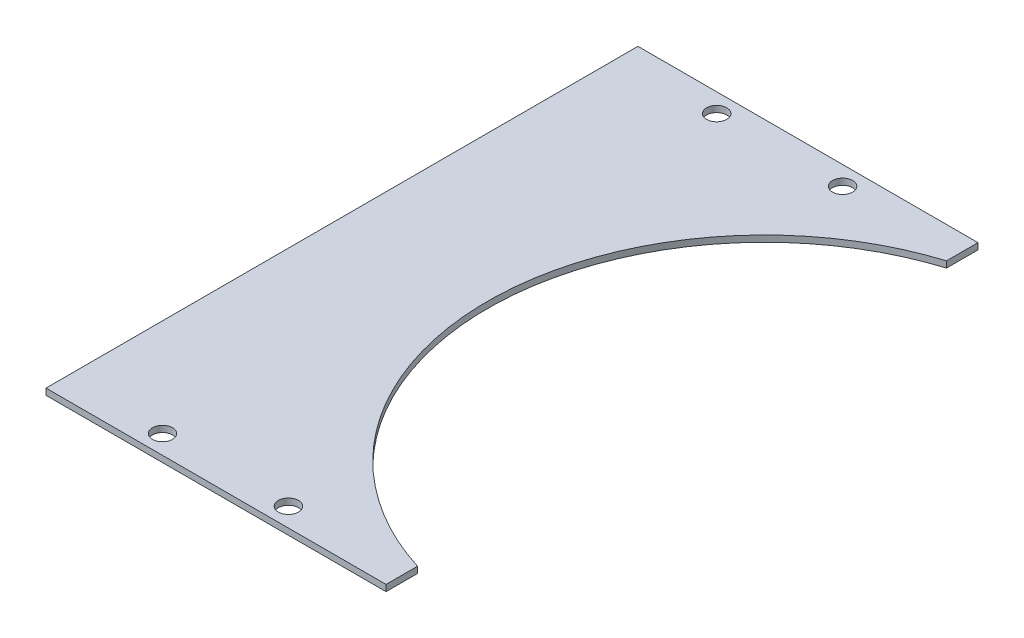
from build123d import *

# Parameters (mm, degrees)
EXTRUDE_1_DEPTH     = 1
SKETCH_3_R          = 1.6
CUT_EXTRUDE_1_DEPTH = 10


with BuildPart() as part:
    # 草图2 → 凸台-拉伸1 (new body)
    with BuildSketch(Plane(origin=(0, 0, 0), x_dir=(1, 0, 0), z_dir=(0, 1, 0))):
        with BuildLine():
            Line((0, -47), (0, 47))
            Line((0, 47), (54, 47))
            Line((54, 47), (54, 42))
            ThreePointArc((54, 42), (23.114877049, 0), (54, -42))
            Line((54, -42), (54, -47))
            Line((54, -47), (0, -47))
        make_face()
    extrude(amount=EXTRUDE_1_DEPTH)

    # 草图3 → 切除-拉伸1 (cut)
    with BuildSketch(Plane(origin=(0, 1, 0), x_dir=(1, 0, 0), z_dir=(0, 1, 0))):
        with Locations(Location((15.5, 44, 0), (0, 0, 270))):
            Circle(SKETCH_3_R)
        with Locations(Location((35.5, 44, 0), (0, 0, 270))):
            Circle(SKETCH_3_R)
        with Locations(Location((15.5, -44, 0), (0, 0, 270))):
            Circle(SKETCH_3_R)
        with Locations(Location((35.5, -44, 0), (0, 0, 270))):
            Circle(SKETCH_3_R)
    extrude(amount=-CUT_EXTRUDE_1_DEPTH, mode=Mode.SUBTRACT)


solid = part.part
